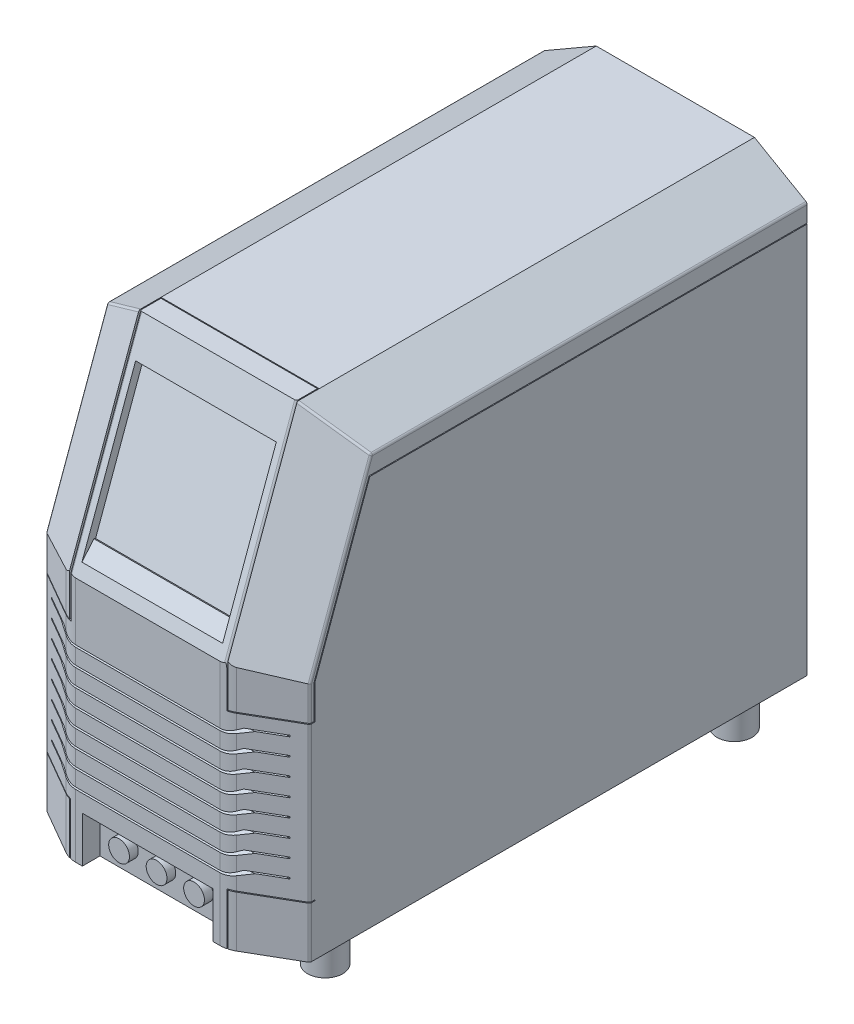
from build123d import *
from OCP.BRepFilletAPI import BRepFilletAPI_MakeChamfer

# Parameters (mm, degrees)
SKETCH_1_W                = 300
SKETCH_1_H                = 600
EXTRUDE_1_DEPTH           = 500
CHAMFER_1_SIZE            = 220
CHAMFER_1_SIZE2           = 80.073451539
CHAMFER_2_SIZE            = 60
CHAMFER_2_SIZE2           = 34.641016151
CHAMFER_3_SIZE            = 60
CHAMFER_3_SIZE2           = 34.641016151
SKETCH_3_W                = 1
SKETCH_3_H                = 227.674368017
CUT_EXTRUDE_1_DEPTH       = 105
SKETCH_4_W                = 180
SKETCH_4_H                = 1
CUT_EXTRUDE_2_DEPTH       = 22
SKETCH_6_W                = 60
SKETCH_6_H                = 1
CUT_EXTRUDE_3_DEPTH       = 40
CUT_EXTRUDE_8_DEPTH       = 36
FILLET_1_R                = 3
CUT_EXTRUDE_9_DEPTH       = 80
SKETCH_10_W               = 160
SKETCH_10_H               = 158.605560504
CUT_EXTRUDE_10_DEPTH      = 2
CUT_EXTRUDE_11_DEPTH      = 375
SKETCH_14_W               = 1
SKETCH_14_H               = 45.813801008
CUT_EXTRUDE_14_DEPTH      = 131
FILLET_2_R                = 2
SKETCH_12_W               = 148.820757316
SKETCH_12_H               = 104.22776766
CUT_EXTRUDE_12_DEPTH      = 20
CUT_EXTRUDE_13_DEPTH      = 129
CUT_EXTRUDE_13_DEPTH_BACK = 131
SKETCH_15_W               = 1
SKETCH_15_H               = 68.74840394
CUT_EXTRUDE_15_DEPTH      = 131
SKETCH_17_W               = 19.222115057
SKETCH_17_H               = 1.617906131
CUT_EXTRUDE_16_DEPTH      = 250.5
CUT_EXTRUDE_17_DEPTH      = 250.5
SKETCH_19_R               = 11.815820343
EXTRUDE_2_DEPTH           = 10
SKETCH_20_R               = 20
EXTRUDE_3_DEPTH           = 40


with BuildPart() as part:
    # 草图1 → 凸台-拉伸1 (new body)
    with BuildSketch(Plane(origin=(0, 0, 0), x_dir=(1, 0, 0), z_dir=(0, 1, 0))):
        Rectangle(SKETCH_1_W, SKETCH_1_H)
    extrude(amount=EXTRUDE_1_DEPTH)

    # 倒角1
    chamfer_1_edges = [part.edges().sort_by_distance(p)[0] for p in [
        (0, 500, 300),
    ]]
    chamfer_1_side = [part.faces().sort_by_distance(p)[0] for p in [
        (0, 250, 300),
    ]]
    chamfer(chamfer_1_edges, length=CHAMFER_1_SIZE, length2=CHAMFER_1_SIZE2, reference=chamfer_1_side[0])

    # 倒角2: one chamfer whose edges measure the first distance from different faces: ONE call of the kernel's chamfer builder (chamfer() names one face for all edges)
    chamfer_2_edges_1 = [part.edges().sort_by_distance(p)[0] for p in [
        (150, 500, -40.036725769),
    ]]
    chamfer_2_side_1 = [part.faces().sort_by_distance(p)[0] for p in [
        (0, 500, -40.036725769),
    ]]
    chamfer_2_edges_2 = [part.edges().sort_by_distance(p)[0] for p in [
        (150, 140, 300),
    ]]
    chamfer_2_side_2 = [part.faces().sort_by_distance(p)[0] for p in [
        (0, 140, 300),
    ]]
    chamfer_2_edges_3 = [part.edges().sort_by_distance(p)[0] for p in [
        (150, 390, 259.963274231),
    ]]
    chamfer_2_side_3 = [part.faces().sort_by_distance(p)[0] for p in [
        (0, 390, 259.963274231),
    ]]
    chamfer_2 = BRepFilletAPI_MakeChamfer(part.part.solid().wrapped)
    for e in chamfer_2_edges_1:
        chamfer_2.Add(CHAMFER_2_SIZE, CHAMFER_2_SIZE2, e.wrapped, chamfer_2_side_1[0].wrapped)  # the first distance lies on this face
    for e in chamfer_2_edges_2:
        chamfer_2.Add(CHAMFER_2_SIZE, CHAMFER_2_SIZE2, e.wrapped, chamfer_2_side_2[0].wrapped)  # the first distance lies on this face
    for e in chamfer_2_edges_3:
        chamfer_2.Add(CHAMFER_2_SIZE, CHAMFER_2_SIZE2, e.wrapped, chamfer_2_side_3[0].wrapped)  # the first distance lies on this face
    add(Compound.cast(chamfer_2.Shape()), mode=Mode.REPLACE)

    # 倒角3: one chamfer whose edges measure the first distance from different faces: ONE call of the kernel's chamfer builder (chamfer() names one face for all edges)
    chamfer_3_edges_1 = [part.edges().sort_by_distance(p)[0] for p in [
        (-150, 500, -40.036725769),
    ]]
    chamfer_3_side_1 = [part.faces().sort_by_distance(p)[0] for p in [
        (-30, 500, -40.036725769),
    ]]
    chamfer_3_edges_2 = [part.edges().sort_by_distance(p)[0] for p in [
        (-150, 140, 300),
    ]]
    chamfer_3_side_2 = [part.faces().sort_by_distance(p)[0] for p in [
        (-30, 140, 300),
    ]]
    chamfer_3_edges_3 = [part.edges().sort_by_distance(p)[0] for p in [
        (-150, 390, 259.963274231),
    ]]
    chamfer_3_side_3 = [part.faces().sort_by_distance(p)[0] for p in [
        (-30, 390, 259.963274231),
    ]]
    chamfer_3 = BRepFilletAPI_MakeChamfer(part.part.solid().wrapped)
    for e in chamfer_3_edges_1:
        chamfer_3.Add(CHAMFER_3_SIZE, CHAMFER_3_SIZE2, e.wrapped, chamfer_3_side_1[0].wrapped)  # the first distance lies on this face
    for e in chamfer_3_edges_2:
        chamfer_3.Add(CHAMFER_3_SIZE, CHAMFER_3_SIZE2, e.wrapped, chamfer_3_side_2[0].wrapped)  # the first distance lies on this face
    for e in chamfer_3_edges_3:
        chamfer_3.Add(CHAMFER_3_SIZE, CHAMFER_3_SIZE2, e.wrapped, chamfer_3_side_3[0].wrapped)  # the first distance lies on this face
    add(Compound.cast(chamfer_3.Shape()), mode=Mode.REPLACE)

    # 草图3 → 切除-拉伸1 (cut)
    with BuildSketch(Plane.XY.offset(300)):
        with Locations((89.5, 393.837184009)):
            Rectangle(SKETCH_3_W, SKETCH_3_H)
        with Locations((-89.5, 393.837184009)):
            Rectangle(SKETCH_3_W, SKETCH_3_H)
    extrude(amount=-CUT_EXTRUDE_1_DEPTH, mode=Mode.SUBTRACT)

    # 草图4 → 切除-拉伸2 (cut)
    with BuildSketch(Plane(origin=(0, 500, 0), x_dir=(1, 0, 0), z_dir=(0, 1, 0))):
        with Locations((0, -195.5)):
            Rectangle(SKETCH_4_W, SKETCH_4_H)
    extrude(amount=-CUT_EXTRUDE_2_DEPTH, mode=Mode.SUBTRACT)

    # 草图6 → 切除-拉伸3 (cut)
    with BuildSketch(Plane.XY.offset(300)):
        with Locations((120, 58.588826951)):
            Rectangle(SKETCH_6_W, SKETCH_6_H)
        with Locations((120, 234.686198992)):
            Rectangle(SKETCH_6_W, SKETCH_6_H)
        with Locations((-120, 234.686198992)):
            Rectangle(SKETCH_6_W, SKETCH_6_H)
        with Locations((-120, 58.588826951)):
            Rectangle(SKETCH_6_W, SKETCH_6_H)
    extrude(amount=-CUT_EXTRUDE_3_DEPTH, mode=Mode.SUBTRACT)

    # 草图8 → 切除-拉伸8 (cut)
    with BuildSketch(Plane(origin=(150, 0, 0), x_dir=(0, 0, -1), z_dir=(1, 0, 0))):
        Polygon((-197.486836495, 444.697454891), (300, 444.697454891), (300, 445.697454891), (-198.187044034, 445.697454891), (-260.998983849, 273.123068577), (-260.998983849, 235.186198992), (-259.998983849, 235.186198992), (-259.998983849, 272.946741597), align=None)
    cut_extrude_8 = extrude(amount=-CUT_EXTRUDE_8_DEPTH, mode=Mode.SUBTRACT)

    # 镜向1: 切除-拉伸8 across plane
    add(cut_extrude_8.mirror(Plane(origin=(0, 0, 0), x_dir=(0, 0, 1), z_dir=(1, 0, 0))), mode=Mode.SUBTRACT)

    # 圆角1
    fillet_1_edges = [part.edges().sort_by_distance(p)[0] for p in [
        (150, 29.044413475, 265.358983849),
        (150, 146.637512971, 265.358983849),
        (-150, 254.539026603, 265.358983849),
        (-150, 146.637512971, 265.358983849),
        (150, 254.539026603, 265.358983849),
        (150, 369.625419031, 230.514815835),
        (150, 465.358983849, -52.16467609),
        (120, 482.679491924, 207.798598141),
        (-150, 29.044413475, 265.358983849),
        (-150, 369.625419031, 230.514815835),
        (-150, 465.358983849, -52.16467609),
        (-120, 482.679491924, 207.798598141),
    ]]
    fillet(fillet_1_edges, radius=FILLET_1_R)

    # 草图9 → 切除-拉伸9 (cut, symmetric)
    with BuildSketch(Plane(origin=(0, 0, 0), x_dir=(0, 0, -1), z_dir=(1, 0, 0))):
        Polygon((-233.815414304, 461.840654716), (-226.995689669, 459.358477944), (-281.241986205, 310.318003123), (-294.881299611, 294.063513735), align=None)
    extrude(amount=CUT_EXTRUDE_9_DEPTH, both=True, mode=Mode.SUBTRACT)

    # 草图10 → 切除-拉伸10 (cut)
    with BuildSketch(Plane(origin=(0, 126.689742644, 348.07720719), x_dir=(1, 0, 0), z_dir=(0, 0.34202014332566577, 0.9396926207859095))):
        with Locations((0, 274.715893452)):
            Rectangle(SKETCH_10_W, SKETCH_10_H)
    extrude(amount=-CUT_EXTRUDE_10_DEPTH, mode=Mode.SUBTRACT)

    # 草图11 → 切除-拉伸11 (cut)
    with BuildSketch(Plane.XZ):
        with BuildLine():
            Line((96.961524227, 295.980762114), (92.48044355, 305.504288979))
            Line((92.48044355, 305.504288979), (81.961524227, 300))
            ThreePointArc((81.961524227, 300), (89.72609558, 298.977774789), (96.961524227, 295.980762114))
        make_face()
        with BuildLine():
            Line((-92.48044355, 305.504288979), (-81.961524227, 300))
            ThreePointArc((-81.961524227, 300), (-89.72609558, 298.977774789), (-96.961524227, 295.980762114))
            Line((-96.961524227, 295.980762114), (-92.48044355, 305.504288979))
        make_face()
    extrude(amount=-CUT_EXTRUDE_11_DEPTH, mode=Mode.SUBTRACT)

    # 草图14 → 切除-拉伸14 (cut)
    with BuildSketch(Plane.XY.offset(300)):
        with Locations((-89.5, 257.093099496)):
            Rectangle(SKETCH_14_W, SKETCH_14_H)
        with Locations((89.5, 257.093099496)):
            Rectangle(SKETCH_14_W, SKETCH_14_H)
    extrude(amount=-CUT_EXTRUDE_14_DEPTH, mode=Mode.SUBTRACT)

    # 圆角2
    fillet_2_edges = [part.edges().sort_by_distance(p)[0] for p in [
        (-89, 391.150307086, 259.544596691),
        (89, 391.150307086, 259.544596691),
        (-89, 258.243406582, 299.162644921),
    ]]
    fillet(fillet_2_edges, radius=FILLET_2_R)

    # 草图12 → 切除-拉伸12 (cut)
    with BuildSketch(Plane.XY.offset(300)):
        Rectangle(SKETCH_12_W, SKETCH_12_H)
    extrude(amount=-CUT_EXTRUDE_12_DEPTH, mode=Mode.SUBTRACT)

    # 草图13 → 切除-拉伸13 (cut, two sides: drawn at the far end of the back side and taken through both)
    with BuildSketch(Plane(origin=(0, 0, 0), x_dir=(0, 0, -1), z_dir=(1, 0, 0)).offset(-CUT_EXTRUDE_13_DEPTH_BACK)):
        Polygon((-311.593282115, 206.986400834), (-289.455590513, 220.621745001), (-288.406717885, 218.918845647), (-310.544409487, 205.28350148), align=None)
        Polygon((-289.455590513, 200.621745001), (-288.406717885, 198.918845647), (-310.544409487, 185.28350148), (-311.593282115, 186.986400834), align=None)
        Polygon((-289.455590513, 180.621745001), (-288.406717885, 178.918845647), (-310.544409487, 165.28350148), (-311.593282115, 166.986400834), align=None)
        Polygon((-289.455590513, 160.621745001), (-288.406717885, 158.918845647), (-310.544409487, 145.28350148), (-311.593282115, 146.986400834), align=None)
        Polygon((-289.455590513, 140.621745001), (-288.406717885, 138.918845647), (-310.544409487, 125.28350148), (-311.593282115, 126.986400834), align=None)
        Polygon((-289.455590513, 120.621745001), (-288.406717885, 118.918845647), (-310.544409487, 105.28350148), (-311.593282115, 106.986400834), align=None)
        Polygon((-289.455590513, 100.621745001), (-288.406717885, 98.918845647), (-310.544409487, 85.28350148), (-311.593282115, 86.986400834), align=None)
        Polygon((-289.455590513, 80.621745001), (-288.406717885, 78.918845647), (-310.544409487, 65.28350148), (-311.593282115, 66.986400834), align=None)
    extrude(amount=CUT_EXTRUDE_13_DEPTH + CUT_EXTRUDE_13_DEPTH_BACK, mode=Mode.SUBTRACT)

    # 草图15 → 切除-拉伸15 (cut)
    with BuildSketch(Plane.XY.offset(300)):
        with Locations((89.5, 24.714624981)):
            Rectangle(SKETCH_15_W, SKETCH_15_H)
        with Locations((-89.5, 24.714624981)):
            Rectangle(SKETCH_15_W, SKETCH_15_H)
    extrude(amount=-CUT_EXTRUDE_15_DEPTH, mode=Mode.SUBTRACT)

    # 草图17 → 切除-拉伸16 (cut, symmetric)
    with BuildSketch(Plane(origin=(0, 0, 0), x_dir=(0, 0, -1), z_dir=(1, 0, 0))):
        with Locations((-283.307778572, 199.891979873)):
            Rectangle(SKETCH_17_W, SKETCH_17_H)
        with Locations((-283.307778572, 219.891979873)):
            Rectangle(SKETCH_17_W, SKETCH_17_H)
        with Locations((-283.307778572, 179.891979873)):
            Rectangle(SKETCH_17_W, SKETCH_17_H)
        with Locations((-283.307778572, 159.891979873)):
            Rectangle(SKETCH_17_W, SKETCH_17_H)
        with Locations((-283.307778572, 139.891979873)):
            Rectangle(SKETCH_17_W, SKETCH_17_H)
        with Locations((-283.307778572, 119.891979873)):
            Rectangle(SKETCH_17_W, SKETCH_17_H)
        with Locations((-283.307778572, 99.891979873)):
            Rectangle(SKETCH_17_W, SKETCH_17_H)
        with Locations((-283.307778572, 79.891979873)):
            Rectangle(SKETCH_17_W, SKETCH_17_H)
    extrude(amount=CUT_EXTRUDE_16_DEPTH, both=True, mode=Mode.SUBTRACT)

    # 草图18 → 切除-拉伸17 (cut, symmetric)
    with BuildSketch(Plane(origin=(0, 0, 0), x_dir=(0, 0, -1), z_dir=(1, 0, 0))):
        Polygon((-292.9188361, 220.700932938), (-300, 214.127090772), (-288.117029354, 220.700932938), align=None)
        Polygon((-292.9188361, 200.700932938), (-300, 194.127090772), (-288.117029354, 200.700932938), align=None)
        Polygon((-292.9188361, 180.700932938), (-300, 174.127090772), (-288.117029354, 180.700932938), align=None)
        Polygon((-292.9188361, 160.700932938), (-300, 154.127090772), (-288.117029354, 160.700932938), align=None)
        Polygon((-292.9188361, 140.700932938), (-300, 134.127090772), (-288.117029354, 140.700932938), align=None)
        Polygon((-292.9188361, 120.700932938), (-300, 114.127090772), (-288.117029354, 120.700932938), align=None)
        Polygon((-292.9188361, 100.700932938), (-300, 94.127090772), (-288.117029354, 100.700932938), align=None)
        Polygon((-292.9188361, 80.700932938), (-300, 74.127090772), (-288.117029354, 80.700932938), align=None)
    extrude(amount=CUT_EXTRUDE_17_DEPTH, both=True, mode=Mode.SUBTRACT)

    # 草图19 → 凸台-拉伸2 (add)
    with BuildSketch(Plane.XY.offset(280)):
        with Locations(Location((0, 26.056941915, 0), (0, 0, 180))):
            Circle(SKETCH_19_R)
        with Locations(Location((-42.640349558, 26.056941915, 0), (0, 0, 180))):
            Circle(SKETCH_19_R)
        with Locations(Location((42.640349558, 26.056941915, 0), (0, 0, 180))):
            Circle(SKETCH_19_R)
    extrude(amount=EXTRUDE_2_DEPTH)

    # 草图20 → 凸台-拉伸3 (add)
    with BuildSketch(Plane.XZ):
        with Locations(Location((-119.706478156, 217.967170323, 0), (0, 0, 270))):
            Circle(SKETCH_20_R)
        with Locations(Location((119.706478156, 217.967170323, 0), (0, 0, 270))):
            Circle(SKETCH_20_R)
        with Locations(Location((119.706478156, -247.601347326, 0), (0, 0, 270))):
            Circle(SKETCH_20_R)
        with Locations(Location((-119.706478156, -247.601347326, 0), (0, 0, 270))):
            Circle(SKETCH_20_R)
    extrude(amount=EXTRUDE_3_DEPTH)


solid = part.part
